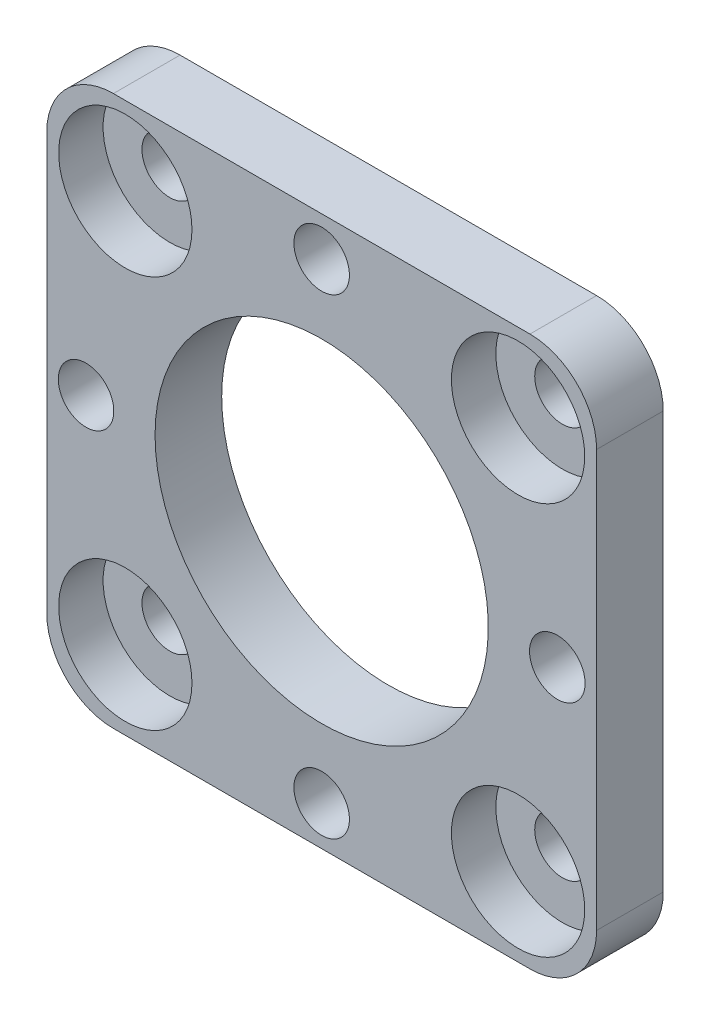
from build123d import *

# Parameters (mm, degrees)
SKETCH_1_R          = 17.5
EXTRUDE_1_DEPTH     = 3
CUT_EXTRUDE_1_REACH = 26.93
SKETCH_2_R          = 1.25
CUT_EXTRUDE_2_REACH = 26.93
SKETCH_3_R          = 1.25
CUT_EXTRUDE_3_REACH = 26.93
SKETCH_4_R          = 7.5
CUT_EXTRUDE_4_REACH = 26.93
FILLET_1_R          = 3
SKETCH_8_R          = 3
CUT_EXTRUDE_5_DEPTH = 2


with BuildPart() as part:
    # 草图1 → 凸台-拉伸1 (new body)
    with BuildSketch(Plane.XY):
        Circle(SKETCH_1_R)
    extrude(amount=EXTRUDE_1_DEPTH)

    # 草图2 → 切除-拉伸1 (cut, up to next)
    with BuildSketch(Plane(origin=(0, 0, 0), x_dir=(-1, 0, 0), z_dir=(0, 0, -1)), mode=Mode.PRIVATE) as cut_extrude_1_sk1:
        with Locations((-8.838834765, 8.838834765)):
            Circle(SKETCH_2_R)
    cut_extrude_1_tool1 = extrude(cut_extrude_1_sk1.sketch, amount=-CUT_EXTRUDE_1_REACH, mode=Mode.PRIVATE) & part.part
    # 草图2 → 切除-拉伸1 (cut, up to next)
    with BuildSketch(Plane(origin=(0, 0, 0), x_dir=(-1, 0, 0), z_dir=(0, 0, -1)), mode=Mode.PRIVATE) as cut_extrude_1_sk2:
        with Locations((8.838834765, 8.838834765)):
            Circle(SKETCH_2_R)
    cut_extrude_1_tool2 = extrude(cut_extrude_1_sk2.sketch, amount=-CUT_EXTRUDE_1_REACH, mode=Mode.PRIVATE) & part.part
    # 草图2 → 切除-拉伸1 (cut, up to next)
    with BuildSketch(Plane(origin=(0, 0, 0), x_dir=(-1, 0, 0), z_dir=(0, 0, -1)), mode=Mode.PRIVATE) as cut_extrude_1_sk3:
        with Locations((8.838834765, -8.838834765)):
            Circle(SKETCH_2_R)
    cut_extrude_1_tool3 = extrude(cut_extrude_1_sk3.sketch, amount=-CUT_EXTRUDE_1_REACH, mode=Mode.PRIVATE) & part.part
    # 草图2 → 切除-拉伸1 (cut, up to next)
    with BuildSketch(Plane(origin=(0, 0, 0), x_dir=(-1, 0, 0), z_dir=(0, 0, -1)), mode=Mode.PRIVATE) as cut_extrude_1_sk4:
        with Locations((-8.838834765, -8.838834765)):
            Circle(SKETCH_2_R)
    cut_extrude_1_tool4 = extrude(cut_extrude_1_sk4.sketch, amount=-CUT_EXTRUDE_1_REACH, mode=Mode.PRIVATE) & part.part
    add(cut_extrude_1_tool1.solids().sort_by_distance((8.838835, 8.838835, 0))[0], mode=Mode.SUBTRACT)
    add(cut_extrude_1_tool2.solids().sort_by_distance((-8.838835, 8.838835, 0))[0], mode=Mode.SUBTRACT)
    add(cut_extrude_1_tool3.solids().sort_by_distance((-8.838835, -8.838835, 0))[0], mode=Mode.SUBTRACT)
    add(cut_extrude_1_tool4.solids().sort_by_distance((8.838835, -8.838835, 0))[0], mode=Mode.SUBTRACT)

    # 草图3 → 切除-拉伸2 (cut, up to next)
    with BuildSketch(Plane(origin=(0, 0, 0), x_dir=(-1, 0, 0), z_dir=(0, 0, -1)), mode=Mode.PRIVATE) as cut_extrude_2_sk1:
        with Locations((0, 10.606601718)):
            Circle(SKETCH_3_R)
    cut_extrude_2_tool1 = extrude(cut_extrude_2_sk1.sketch, amount=-CUT_EXTRUDE_2_REACH, mode=Mode.PRIVATE) & part.part
    # 草图3 → 切除-拉伸2 (cut, up to next)
    with BuildSketch(Plane(origin=(0, 0, 0), x_dir=(-1, 0, 0), z_dir=(0, 0, -1)), mode=Mode.PRIVATE) as cut_extrude_2_sk2:
        with Locations((-10.606601718, 0)):
            Circle(SKETCH_3_R)
    cut_extrude_2_tool2 = extrude(cut_extrude_2_sk2.sketch, amount=-CUT_EXTRUDE_2_REACH, mode=Mode.PRIVATE) & part.part
    # 草图3 → 切除-拉伸2 (cut, up to next)
    with BuildSketch(Plane(origin=(0, 0, 0), x_dir=(-1, 0, 0), z_dir=(0, 0, -1)), mode=Mode.PRIVATE) as cut_extrude_2_sk3:
        with Locations((0, -10.606601718)):
            Circle(SKETCH_3_R)
    cut_extrude_2_tool3 = extrude(cut_extrude_2_sk3.sketch, amount=-CUT_EXTRUDE_2_REACH, mode=Mode.PRIVATE) & part.part
    # 草图3 → 切除-拉伸2 (cut, up to next)
    with BuildSketch(Plane(origin=(0, 0, 0), x_dir=(-1, 0, 0), z_dir=(0, 0, -1)), mode=Mode.PRIVATE) as cut_extrude_2_sk4:
        with Locations((10.606601718, 0)):
            Circle(SKETCH_3_R)
    cut_extrude_2_tool4 = extrude(cut_extrude_2_sk4.sketch, amount=-CUT_EXTRUDE_2_REACH, mode=Mode.PRIVATE) & part.part
    add(cut_extrude_2_tool1.solids().sort_by_distance((0, 10.606602, 0))[0], mode=Mode.SUBTRACT)
    add(cut_extrude_2_tool2.solids().sort_by_distance((10.606602, 0, 0))[0], mode=Mode.SUBTRACT)
    add(cut_extrude_2_tool3.solids().sort_by_distance((0, -10.606602, 0))[0], mode=Mode.SUBTRACT)
    add(cut_extrude_2_tool4.solids().sort_by_distance((-10.606602, 0, 0))[0], mode=Mode.SUBTRACT)

    # 草图4 → 切除-拉伸3 (cut, up to next)
    with BuildSketch(Plane(origin=(0, 0, 0), x_dir=(-1, 0, 0), z_dir=(0, 0, -1)), mode=Mode.PRIVATE) as cut_extrude_3_sk1:
        Circle(SKETCH_4_R)
    cut_extrude_3_tool1 = extrude(cut_extrude_3_sk1.sketch, amount=-CUT_EXTRUDE_3_REACH, mode=Mode.PRIVATE) & part.part
    add(cut_extrude_3_tool1.solids().sort_by_distance((0, 0, 0))[0], mode=Mode.SUBTRACT)

    # 草图7 → 切除-拉伸4 (cut, up to next)
    with BuildSketch(Plane.XY.offset(3), mode=Mode.PRIVATE) as cut_extrude_4_sk1:
        with BuildLine():
            Line((-12.374368671, 12.374368671), (12.374368671, 12.374368671))
            ThreePointArc((12.374368671, 12.374368671), (0, 17.5), (-12.374368671, 12.374368671))
        make_face()
    cut_extrude_4_tool1 = extrude(cut_extrude_4_sk1.sketch, amount=-CUT_EXTRUDE_4_REACH, mode=Mode.PRIVATE) & part.part
    # 草图7 → 切除-拉伸4 (cut, up to next)
    with BuildSketch(Plane.XY.offset(3), mode=Mode.PRIVATE) as cut_extrude_4_sk2:
        with BuildLine():
            Line((12.374368671, 12.374368671), (12.374368671, -12.374368671))
            ThreePointArc((12.374368671, -12.374368671), (16.167891819, -6.696960066), (17.5, 0))
            ThreePointArc((17.5, 0), (16.167891819, 6.696960066), (12.374368671, 12.374368671))
        make_face()
    cut_extrude_4_tool2 = extrude(cut_extrude_4_sk2.sketch, amount=-CUT_EXTRUDE_4_REACH, mode=Mode.PRIVATE) & part.part
    # 草图7 → 切除-拉伸4 (cut, up to next)
    with BuildSketch(Plane.XY.offset(3), mode=Mode.PRIVATE) as cut_extrude_4_sk3:
        with BuildLine():
            ThreePointArc((-12.374368671, -12.374368671), (0, -17.5), (12.374368671, -12.374368671))
            Line((12.374368671, -12.374368671), (-12.374368671, -12.374368671))
        make_face()
    cut_extrude_4_tool3 = extrude(cut_extrude_4_sk3.sketch, amount=-CUT_EXTRUDE_4_REACH, mode=Mode.PRIVATE) & part.part
    # 草图7 → 切除-拉伸4 (cut, up to next)
    with BuildSketch(Plane.XY.offset(3), mode=Mode.PRIVATE) as cut_extrude_4_sk4:
        with BuildLine():
            ThreePointArc((-12.374368671, 12.374368671), (-17.5, 0), (-12.374368671, -12.374368671))
            Line((-12.374368671, -12.374368671), (-12.374368671, 12.374368671))
        make_face()
    cut_extrude_4_tool4 = extrude(cut_extrude_4_sk4.sketch, amount=-CUT_EXTRUDE_4_REACH, mode=Mode.PRIVATE) & part.part
    add(cut_extrude_4_tool1.solids().sort_by_distance((0, 14.452754, 3))[0], mode=Mode.SUBTRACT)
    add(cut_extrude_4_tool2.solids().sort_by_distance((14.452754, 0, 3))[0], mode=Mode.SUBTRACT)
    add(cut_extrude_4_tool3.solids().sort_by_distance((0, -14.452754, 3))[0], mode=Mode.SUBTRACT)
    add(cut_extrude_4_tool4.solids().sort_by_distance((-14.452754, 0, 3))[0], mode=Mode.SUBTRACT)

    # 圆角1
    fillet_1_edges = [part.edges().sort_by_distance(p)[0] for p in [
        (12.374368671, 12.374368671, 1.5),
        (-12.374368671, 12.374368671, 1.5),
        (-12.374368671, -12.374368671, 1.5),
        (12.374368671, -12.374368671, 1.5),
    ]]
    fillet(fillet_1_edges, radius=FILLET_1_R)

    # 草图8 → 切除-拉伸5 (cut)
    with BuildSketch(Plane.XY.offset(3)):
        with Locations((-8.838834765, 8.838834765)):
            Circle(SKETCH_8_R)
        with Locations((8.838834765, 8.838834765)):
            Circle(SKETCH_8_R)
        with Locations((8.838834765, -8.838834765)):
            Circle(SKETCH_8_R)
        with Locations((-8.838834765, -8.838834765)):
            Circle(SKETCH_8_R)
    extrude(amount=-CUT_EXTRUDE_5_DEPTH, mode=Mode.SUBTRACT)


solid = part.part
